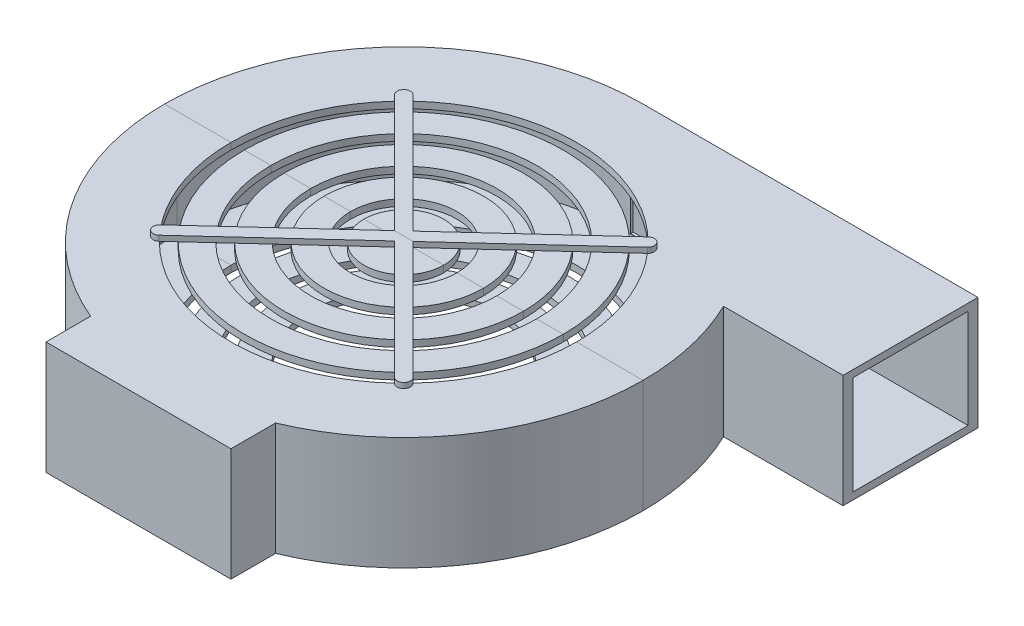
from build123d import *

# Parameters (mm, degrees)
SZKIC1_R                      = 180
SZKIC1_R_2                    = 170.616331517
DODANIE_WYCI_GNI_CIE2_DEPTH   = 85
SZKIC2_R                      = 170.616331517
SZKIC2_R_2                    = 130
DODANIE_WYCI_GNI_CIE3_DEPTH   = 5
DODANIE_WYCI_GNI_CIE6_START   = 5
SZKIC3_R                      = 170.616331517
SZKIC3_R_2                    = 130
DODANIE_WYCI_GNI_CIE6_DEPTH   = 5
SZKIC4_R                      = 120
SZKIC4_R_2                    = 100
DODANIE_WYCI_GNI_CIE7_DEPTH   = 5
SZKIC4_R_3                    = 90
SZKIC4_R_4                    = 70
DODANIE_WYCI_GNI_CIE7_2_DEPTH = 5
SZKIC4_R_5                    = 60
SZKIC4_R_6                    = 40
DODANIE_WYCI_GNI_CIE7_3_DEPTH = 5
SZKIC4_R_7                    = 30
DODANIE_WYCI_GNI_CIE7_4_DEPTH = 5
SZKIC5_R                      = 120
SZKIC5_R_2                    = 100
DODANIE_WYCI_GNI_CIE8_DEPTH   = 5
SZKIC5_R_3                    = 90
SZKIC5_R_4                    = 70
DODANIE_WYCI_GNI_CIE8_2_DEPTH = 5
SZKIC5_R_5                    = 60
SZKIC5_R_6                    = 40
DODANIE_WYCI_GNI_CIE8_3_DEPTH = 5
SZKIC5_R_7                    = 30
DODANIE_WYCI_GNI_CIE8_4_DEPTH = 5
SZKIC6_W                      = 86.484372842
SZKIC6_H                      = 74.403700188
WYTNIJ_WYCI_GNI_CIE2_DEPTH    = 252
DODANIE_WYCI_GNI_CIE9_DEPTH   = 4
SZKIC9_R                      = 70.332086469
WYTNIJ_WYCI_GNI_CIE4_DEPTH    = 20


with BuildPart() as part:
    # Szkic1 → Dodanie-wyciągnięcie2 (new body)
    # profile 1 of 3: a face of its own
    with BuildSketch(Plane(origin=(0, 0, 0), x_dir=(1, 0, 0), z_dir=(0, 1, 0))):
        with Locations((-20.454545455, 199.586646916)):
            Circle(SZKIC1_R)
        with Locations(Location((-20.454545455, 199.586646916, 0), (0, 0, 270))):
            Circle(SZKIC1_R_2, mode=Mode.SUBTRACT)
    # profile 2 of 3: a face of its own
    with BuildSketch(Plane(origin=(0, 0, 0), x_dir=(1, 0, 0), z_dir=(0, 1, 0))):
        with BuildLine():
            Line((231.520301567, 379.586646916), (-20.454545455, 379.586646916))
            ThreePointArc((-20.454545455, 379.586646916), (75.116954083, 352.118900804), (141.520301567, 278.098741096))
            Line((141.520301567, 278.098741096), (231.520301567, 278.098741096))
            Line((231.520301567, 278.098741096), (231.520301567, 379.586646916))
        make_face()
    # profile 3 of 3: a face of its own
    with BuildSketch(Plane(origin=(0, 0, 0), x_dir=(1, 0, 0), z_dir=(0, 1, 0))):
        with BuildLine():
            Line((-90.015935351, 0), (49.106844442, 0))
            Line((49.106844442, 0), (49.106844442, 33.570945744))
            ThreePointArc((49.106844442, 33.570945744), (-20.454545455, 19.586646916), (-90.015935351, 33.570945744))
            Line((-90.015935351, 33.570945744), (-90.015935351, 0))
        make_face()
    extrude(amount=DODANIE_WYCI_GNI_CIE2_DEPTH)

    # Szkic2 → Dodanie-wyciągnięcie3 (add)
    with BuildSketch(Plane(origin=(0, 0, 0), x_dir=(1, 0, 0), z_dir=(0, 1, 0))):
        with Locations(Location((-20.454545455, 199.586646916, 0), (0, 0, 270))):
            Circle(SZKIC2_R)
        with Locations(Location((-20.454545455, 199.586646916, 0), (0, 0, 270))):
            Circle(SZKIC2_R_2, mode=Mode.SUBTRACT)
    extrude(amount=DODANIE_WYCI_GNI_CIE3_DEPTH)

    # Szkic3 → Dodanie-wyciągnięcie6 (add)
    with BuildSketch(Plane(origin=(0, 85, 0), x_dir=(-1, 0, 0), z_dir=(0, -1, 0)).offset(DODANIE_WYCI_GNI_CIE6_START)):
        with Locations(Location((20.454545455, 199.586646916, 0), (0, 0, 90))):
            Circle(SZKIC3_R)
        with Locations(Location((20.454545455, 199.586646916, 0), (0, 0, 270))):
            Circle(SZKIC3_R_2, mode=Mode.SUBTRACT)
    extrude(amount=-DODANIE_WYCI_GNI_CIE6_DEPTH)

    # Szkic6 → Wytnij-wyciągnięcie2 (cut)
    with BuildSketch(Plane(origin=(231.520301567, 0, 0), x_dir=(0, 0, -1), z_dir=(1, 0, 0))):
        with Locations((328.897356387, 42.5)):
            Rectangle(SZKIC6_W, SZKIC6_H)
    extrude(amount=-WYTNIJ_WYCI_GNI_CIE2_DEPTH, mode=Mode.SUBTRACT)



with BuildPart() as body_2:
    # Szkic4 → Dodanie-wyciągnięcie7 (new body)
    with BuildSketch(Plane(origin=(0, 85, 0), x_dir=(-1, 0, 0), z_dir=(0, -1, 0))):
        with Locations(Location((20.454545455, 199.586646916, 0), (0, 0, 90))):
            Circle(SZKIC4_R)
        with Locations(Location((20.454545455, 199.586646916, 0), (0, 0, 90))):
            Circle(SZKIC4_R_2, mode=Mode.SUBTRACT)
    extrude(amount=DODANIE_WYCI_GNI_CIE7_DEPTH)


with BuildPart() as body_3:
    # Szkic4 → Dodanie-wyci_gni_cie7 2 (new body)
    with BuildSketch(Plane(origin=(0, 85, 0), x_dir=(-1, 0, 0), z_dir=(0, -1, 0))):
        with Locations(Location((20.454545455, 199.586646916, 0), (0, 0, 90))):
            Circle(SZKIC4_R_3)
        with Locations(Location((20.454545455, 199.586646916, 0), (0, 0, 90))):
            Circle(SZKIC4_R_4, mode=Mode.SUBTRACT)
    extrude(amount=DODANIE_WYCI_GNI_CIE7_2_DEPTH)


with BuildPart() as body_4:
    # Szkic4 → Dodanie-wyci_gni_cie7 3 (new body)
    with BuildSketch(Plane(origin=(0, 85, 0), x_dir=(-1, 0, 0), z_dir=(0, -1, 0))):
        with Locations(Location((20.454545455, 199.586646916, 0), (0, 0, 90))):
            Circle(SZKIC4_R_5)
        with Locations(Location((20.454545455, 199.586646916, 0), (0, 0, 90))):
            Circle(SZKIC4_R_6, mode=Mode.SUBTRACT)
    extrude(amount=DODANIE_WYCI_GNI_CIE7_3_DEPTH)


with BuildPart() as body_5:
    # Szkic4 → Dodanie-wyci_gni_cie7 4 (new body)
    with BuildSketch(Plane(origin=(0, 85, 0), x_dir=(-1, 0, 0), z_dir=(0, -1, 0))):
        with Locations(Location((20.454545455, 199.586646916, 0), (0, 0, 90))):
            Circle(SZKIC4_R_7)
    extrude(amount=DODANIE_WYCI_GNI_CIE7_4_DEPTH)


with BuildPart() as body_6:
    # Szkic5 → Dodanie-wyciągnięcie8 (new body)
    with BuildSketch(Plane(origin=(0, 0, 0), x_dir=(1, 0, 0), z_dir=(0, 1, 0))):
        with Locations(Location((-20.454545455, 199.586646916, 0), (0, 0, 270))):
            Circle(SZKIC5_R)
        with Locations(Location((-20.454545455, 199.586646916, 0), (0, 0, 270))):
            Circle(SZKIC5_R_2, mode=Mode.SUBTRACT)
    extrude(amount=DODANIE_WYCI_GNI_CIE8_DEPTH)


with BuildPart() as body_7:
    # Szkic5 → Dodanie-wyci_gni_cie8 2 (new body)
    with BuildSketch(Plane(origin=(0, 0, 0), x_dir=(1, 0, 0), z_dir=(0, 1, 0))):
        with Locations(Location((-20.454545455, 199.586646916, 0), (0, 0, 270))):
            Circle(SZKIC5_R_3)
        with Locations(Location((-20.454545455, 199.586646916, 0), (0, 0, 270))):
            Circle(SZKIC5_R_4, mode=Mode.SUBTRACT)
    extrude(amount=DODANIE_WYCI_GNI_CIE8_2_DEPTH)


with BuildPart() as body_8:
    # Szkic5 → Dodanie-wyci_gni_cie8 3 (new body)
    with BuildSketch(Plane(origin=(0, 0, 0), x_dir=(1, 0, 0), z_dir=(0, 1, 0))):
        with Locations(Location((-20.454545455, 199.586646916, 0), (0, 0, 270))):
            Circle(SZKIC5_R_5)
        with Locations(Location((-20.454545455, 199.586646916, 0), (0, 0, 270))):
            Circle(SZKIC5_R_6, mode=Mode.SUBTRACT)
    extrude(amount=DODANIE_WYCI_GNI_CIE8_3_DEPTH)


with BuildPart() as body_9:
    # Szkic5 → Dodanie-wyci_gni_cie8 4 (new body)
    with BuildSketch(Plane(origin=(0, 0, 0), x_dir=(1, 0, 0), z_dir=(0, 1, 0))):
        with Locations(Location((-20.454545455, 199.586646916, 0), (0, 0, 270))):
            Circle(SZKIC5_R_7)
    extrude(amount=DODANIE_WYCI_GNI_CIE8_4_DEPTH)


with BuildPart() as part_1:
    add(part.part)

    add(body_2.part)  # Dodanie-wyciągnięcie9 merges body 2

    add(body_3.part)  # Dodanie-wyciągnięcie9 merges body 3

    add(body_4.part)  # Dodanie-wyciągnięcie9 merges body 4

    add(body_5.part)  # Dodanie-wyciągnięcie9 merges body 5
    # Szkic8 → Dodanie-wyciągnięcie9 (add)
    with BuildSketch(Plane(origin=(0, 85, 0), x_dir=(-1, 0, 0), z_dir=(0, -1, 0))):
        with BuildLine():
            Line((-72.089493868, 291.010650899), (20.182805981, 206.310284476))
            Line((20.182805981, 206.310284476), (108.880738492, 295.008216987))
            ThreePointArc((108.880738492, 295.008216987), (115.876115525, 295.008216987), (115.876115525, 288.012839954))
            Line((115.876115525, 288.012839954), (27.477486462, 199.614210891))
            Line((27.477486462, 199.614210891), (119.449121567, 115.18983644))
            ThreePointArc((119.449121567, 115.18983644), (119.737449925, 108.450971291), (112.998584777, 108.162642933))
            Line((112.998584777, 108.162642933), (20.726284928, 192.863009356))
            Line((20.726284928, 192.863009356), (-67.971647583, 104.165076845))
            ThreePointArc((-67.971647583, 104.165076845), (-74.967024616, 104.165076845), (-74.967024616, 111.160453879))
            Line((-74.967024616, 111.160453879), (13.431604447, 199.559082942))
            Line((13.431604447, 199.559082942), (-78.540030658, 283.983457393))
            ThreePointArc((-78.540030658, 283.983457393), (-78.828359016, 290.722322541), (-72.089493868, 291.010650899))
        make_face()
    extrude(amount=-DODANIE_WYCI_GNI_CIE9_DEPTH)


with BuildPart() as wytnij_wyci_gni_cie4_tool:
    # Szkic9 → Wytnij-wyciągnięcie4 (new body)
    with BuildSketch(Plane(origin=(0, -10, 0), x_dir=(-1, 0, 0), z_dir=(0, -1, 0))):
        with Locations(Location((20.454545455, 199.586646916, 0), (0, 0, 270))):
            Circle(SZKIC9_R)
    extrude(amount=-WYTNIJ_WYCI_GNI_CIE4_DEPTH)


with BuildPart() as body_7_1:
    add(body_7.part)

    # Wytnij-wyciągnięcie4: cut by wytnij_wyci_gni_cie4_tool
    add(wytnij_wyci_gni_cie4_tool.part, mode=Mode.SUBTRACT)


with BuildPart() as body_8_1:
    add(body_8.part)

    # Wytnij-wyciągnięcie4: cut by wytnij_wyci_gni_cie4_tool
    add(wytnij_wyci_gni_cie4_tool.part, mode=Mode.SUBTRACT)


with BuildPart() as body_9_1:
    add(body_9.part)

    # Wytnij-wyciągnięcie4: cut by wytnij_wyci_gni_cie4_tool
    add(wytnij_wyci_gni_cie4_tool.part, mode=Mode.SUBTRACT)


with BuildPart() as body_4_2:
    # Podziel2: the piece on the far side of the plane
    add(part_1.part)
    split(bisect_by=Plane.XY.offset(-199.586646916), keep=Keep.BOTTOM)


with BuildPart() as part_2:
    add(part_1.part)

    # Podziel2
    split(bisect_by=Plane.XY.offset(-199.586646916), keep=Keep.TOP)


solid = Compound([body_6.part, body_7_1.part, body_4_2.part, part_2.part])
